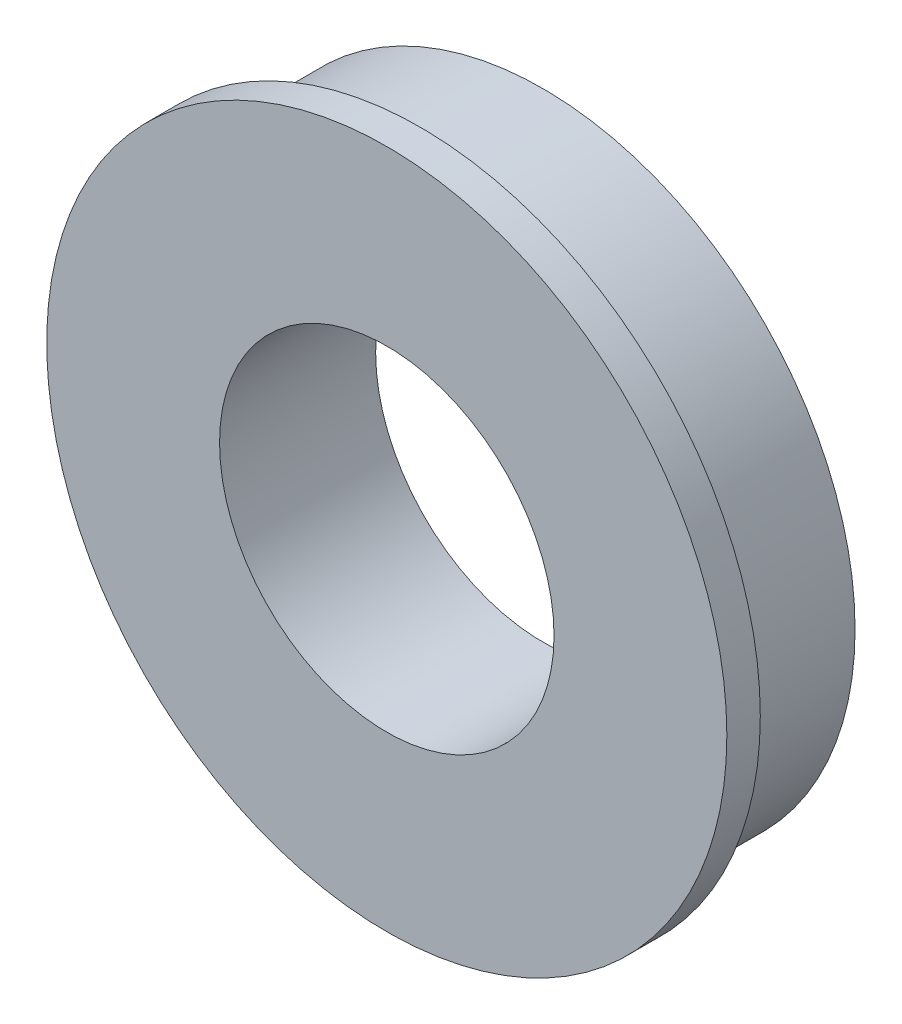
from build123d import *

# Parameters (mm, degrees)
SKETCH_1_R          = 14
EXTRUDE_1_DEPTH     = 5.5
SKETCH_2_R          = 15.25
EXTRUDE_2_DEPTH     = 1.5
CUT_EXTRUDE_1_REACH = 24.674
SKETCH_3_R          = 7.5


with BuildPart() as part:
    # 草图1 → 凸台-拉伸1 (new body)
    with BuildSketch(Plane.XY):
        Circle(SKETCH_1_R)
    extrude(amount=EXTRUDE_1_DEPTH)

    # 草图2 → 凸台-拉伸2 (add)
    with BuildSketch(Plane.XY.offset(5.5)):
        Circle(SKETCH_2_R)
    extrude(amount=EXTRUDE_2_DEPTH)

    # 草图3 → 切除-拉伸1 (cut, up to next)
    with BuildSketch(Plane(origin=(0, 0, 0), x_dir=(-1, 0, 0), z_dir=(0, 0, -1)), mode=Mode.PRIVATE) as cut_extrude_1_sk1:
        Circle(SKETCH_3_R)
    cut_extrude_1_tool1 = extrude(cut_extrude_1_sk1.sketch, amount=-CUT_EXTRUDE_1_REACH, mode=Mode.PRIVATE) & part.part
    add(cut_extrude_1_tool1.solids().sort_by_distance((0, 0, 0))[0], mode=Mode.SUBTRACT)


solid = part.part
